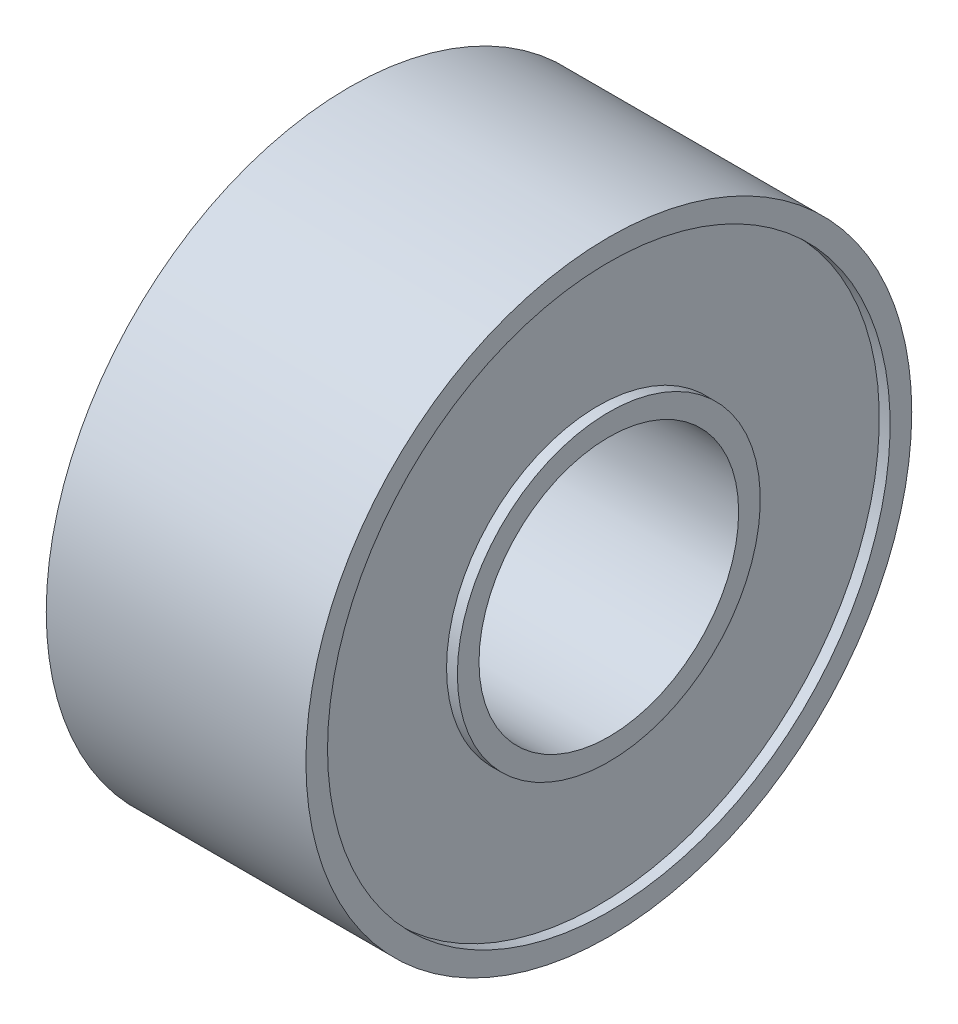
from build123d import *


with BuildPart() as part:
    # Sketch1 → Revolve1 (revolve)
    with BuildSketch(Plane.XY, mode=Mode.PRIVATE) as revolve1_sk:
        Polygon((0, 14), (12, 14), (12, 13), (11.5, 13), (11.5, 7), (12, 7), (12, 6), (0, 6), (0, 7), (0.5, 7), (0.5, 13), (0, 13), align=None)
    revolve(revolve1_sk.sketch.rotate(Axis((0, 0, 0), (1, 0, 0)), 90), axis=Axis((0, 0, 0), (1, 0, 0)))


solid = part.part
